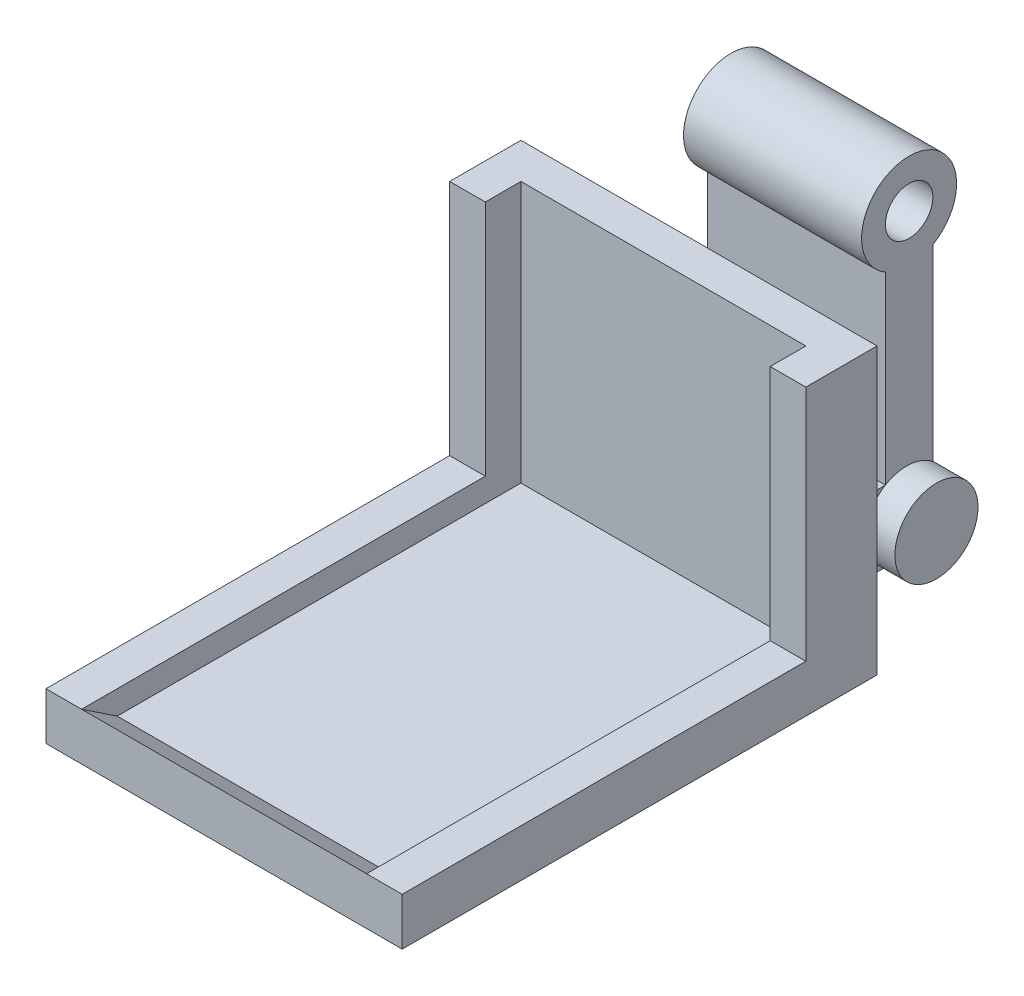
from build123d import *

# Parameters (mm, degrees)
SKETCH2_R           = 1.75
BOSS_EXTRUDE1_DEPTH = 10
SKETCH3_W           = 7.5
SKETCH3_H           = 3
BOSS_EXTRUDE2_DEPTH = 5
SKETCH4_W           = 15
SKETCH4_H           = 2
BOSS_EXTRUDE3_DEPTH = 20
SKETCH5_W           = 12
SKETCH5_H           = 17
CUT_EXTRUDE1_DEPTH  = 1
CUT_EXTRUDE2_DEPTH  = 12
BOSS_EXTRUDE4_DEPTH = 10
SKETCH8_W           = 7.5
SKETCH8_H           = 2
BOSS_EXTRUDE5_DEPTH = 11
BOSS_EXTRUDE6_START = -7.5
SKETCH9_R           = 2
BOSS_EXTRUDE6_DEPTH = 7.5
SKETCH10_R          = 1
CUT_EXTRUDE3_DEPTH  = 31.340772897


with BuildPart() as part:
    # Sketch2 → Boss-Extrude1 (new body)
    with BuildSketch(Plane(origin=(0, 0, 0), x_dir=(0, 0, -1), z_dir=(1, 0, 0))):
        Circle(SKETCH2_R)
    extrude(amount=BOSS_EXTRUDE1_DEPTH)

    # Sketch3 → Boss-Extrude2 (add)
    with BuildSketch(Plane.XY):
        with Locations((5, 0)):
            Rectangle(SKETCH3_W, SKETCH3_H)
    extrude(amount=BOSS_EXTRUDE2_DEPTH)

    # Sketch4 → Boss-Extrude3 (add)
    with BuildSketch(Plane.XY.offset(5)):
        with Locations((5, -0.5)):
            Rectangle(SKETCH4_W, SKETCH4_H)
    extrude(amount=BOSS_EXTRUDE3_DEPTH)

    # Sketch5 → Cut-Extrude1 (cut)
    with BuildSketch(Plane(origin=(0, 0.5, 0), x_dir=(1, 0, 0), z_dir=(0, 1, 0))):
        with Locations((5, -15)):
            Rectangle(SKETCH5_W, SKETCH5_H)
    extrude(amount=-CUT_EXTRUDE1_DEPTH, mode=Mode.SUBTRACT)

    # Sketch6 → Cut-Extrude2 (cut)
    with BuildSketch(Plane.ZY.offset(-11)):
        Polygon((23.5, -0.5), (25, 0.5), (23.5, 0.5), align=None)
    extrude(amount=CUT_EXTRUDE2_DEPTH, mode=Mode.SUBTRACT)

    # Sketch7 → Boss-Extrude4 (add)
    with BuildSketch(Plane(origin=(0, 0.5, 0), x_dir=(1, 0, 0), z_dir=(0, 1, 0))):
        Polygon((-2.5, -5), (12.5, -5), (12.5, -8), (11, -8), (11, -6.5), (-1, -6.5), (-1, -8), (-2.5, -8), align=None)
    extrude(amount=BOSS_EXTRUDE4_DEPTH)

    # Sketch8 → Boss-Extrude5 (add)
    with BuildSketch(Plane(origin=(0, 0, 0), x_dir=(1, 0, 0), z_dir=(0, 1, 0))):
        with Locations((5, 0.098612181)):
            Rectangle(SKETCH8_W, SKETCH8_H)
    extrude(amount=BOSS_EXTRUDE5_DEPTH)

    # Sketch9 → Boss-Extrude6 (add)
    with BuildSketch(Plane.ZY.offset(-1.25).offset(BOSS_EXTRUDE6_START)):
        with Locations((-0.098612181, 11)):
            Circle(SKETCH9_R)
    extrude(amount=BOSS_EXTRUDE6_DEPTH)

    # Sketch10 → Cut-Extrude3 (cut, through all)
    with BuildSketch(Plane.ZY.offset(-1.25)):
        with Locations((-0.098612181, 11)):
            Circle(SKETCH10_R)
    extrude(amount=-CUT_EXTRUDE3_DEPTH, mode=Mode.SUBTRACT)


solid = part.part
